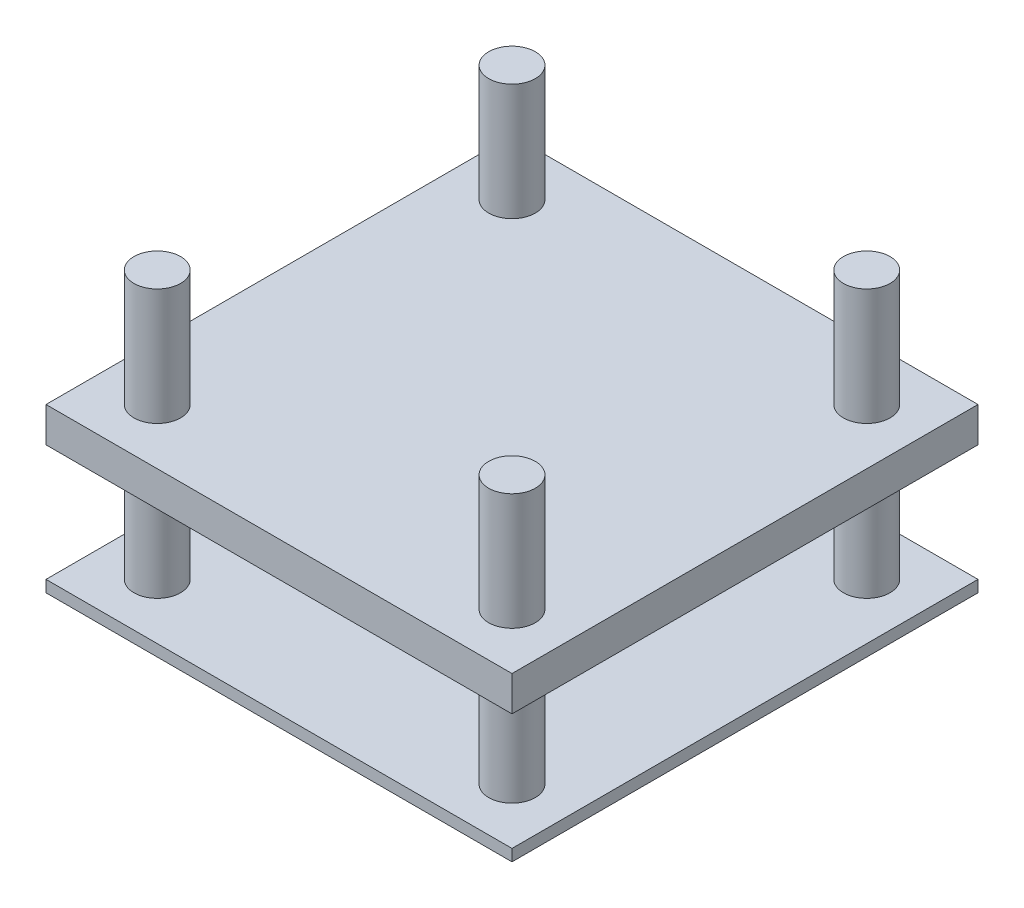
from build123d import *

# Parameters (mm, degrees)
SKETCH_2_W          = 40
SKETCH_2_H          = 40
EXTRUDE_2_DEPTH     = 1
SKETCH_3_R          = 2
CUT_EXTRUDE_1_DEPTH = 3
EXTRUDE_START       = 10
SKETCH_9_W          = 40
SKETCH_9_H          = 40
EXTRUDE_4_DEPTH     = 3
SKETCH_3_3_R        = 2
EXTRUDE_5_DEPTH     = 24
EXTRUDE_START_2     = -2
SKETCH_2_8_R        = 2
EXTRUDE_6_DEPTH     = 2
SKETCH_2_9_W        = 19.5
SKETCH_2_9_H        = 19.5
CUT_EXTRUDE_2_DEPTH = 10


with BuildPart() as part:
    # 草图2 → 凸台-拉伸2 (new body)
    with BuildSketch(Plane(origin=(0, 0, 0), x_dir=(1, 0, 0), z_dir=(0, 1, 0))):
        Rectangle(SKETCH_2_W, SKETCH_2_H)
    extrude(amount=EXTRUDE_2_DEPTH)

    # 草图3 → 切除-拉伸1 (cut)
    with BuildSketch(Plane(origin=(0, 0, 0), x_dir=(1, 0, 0), z_dir=(0, 1, 0))):
        with Locations((-15.224798987, -15.224798987)):
            Circle(SKETCH_3_R)
        with Locations((15.224798987, -15.224798987)):
            Circle(SKETCH_3_R)
        with Locations((15.224798987, 15.224798987)):
            Circle(SKETCH_3_R)
        with Locations((-15.224798987, 15.224798987)):
            Circle(SKETCH_3_R)
    extrude(amount=CUT_EXTRUDE_1_DEPTH, mode=Mode.SUBTRACT)



with BuildPart() as body_2:
    # 草图9 → 凸台-拉伸4 (new body)
    with BuildSketch(Plane(origin=(0, 1, 0), x_dir=(1, 0, 0), z_dir=(0, 1, 0)).offset(EXTRUDE_START)):
        Rectangle(SKETCH_9_W, SKETCH_9_H)
    extrude(amount=EXTRUDE_4_DEPTH)

    # 草图3<3> → 凸台-拉伸5 (add)
    with BuildSketch(Plane(origin=(0, 0, 0), x_dir=(1, 0, 0), z_dir=(0, 1, 0))):
        with Locations((-15.224798987, -15.224798987)):
            Circle(SKETCH_3_3_R)
        with Locations((15.224798987, -15.224798987)):
            Circle(SKETCH_3_3_R)
        with Locations((15.224798987, 15.224798987)):
            Circle(SKETCH_3_3_R)
        with Locations((-15.224798987, 15.224798987)):
            Circle(SKETCH_3_3_R)
    extrude(amount=EXTRUDE_5_DEPTH)


with BuildPart() as part_1:
    add(part.part)

    add(body_2.part)  # 凸台-拉伸6 merges body 2
    # 草图2<8> → 凸台-拉伸6 (add)
    with BuildSketch(Plane(origin=(0, 0, 0), x_dir=(1, 0, 0), z_dir=(0, 1, 0)).offset(EXTRUDE_START_2)):
        with Locations((15.224798987, 15.224798987)):
            Circle(SKETCH_2_8_R)
        with Locations((-15.224798987, -15.224798987)):
            Circle(SKETCH_2_8_R)
        with Locations((15.224798987, -15.224798987)):
            Circle(SKETCH_2_8_R)
        with Locations((-15.224798987, 15.224798987)):
            Circle(SKETCH_2_8_R)
    extrude(amount=EXTRUDE_6_DEPTH)

    # 草图2<9> → 切除-拉伸2 (cut)
    with BuildSketch(Plane(origin=(0, 0, 0), x_dir=(1, 0, 0), z_dir=(0, 1, 0))):
        Rectangle(SKETCH_2_9_W, SKETCH_2_9_H)
    extrude(amount=CUT_EXTRUDE_2_DEPTH, mode=Mode.SUBTRACT)


solid = part_1.part
